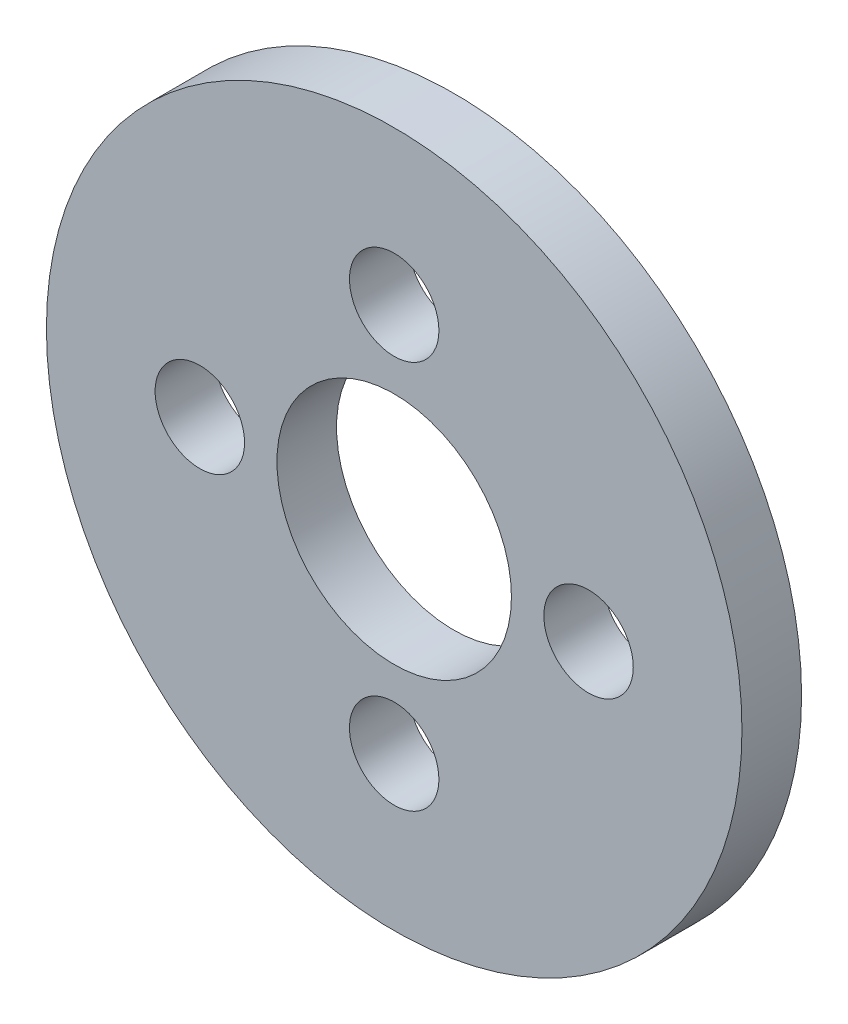
from build123d import *

# Parameters (mm, degrees)
SKETCH1_R           = 17.5
SKETCH1_R_2         = 5.9
BOSS_EXTRUDE1_DEPTH = 3
SKETCH3_R           = 2.25
CUT_EXTRUDE2_DEPTH  = 3


with BuildPart() as part:
    # Sketch1 → Boss-Extrude1 (new body)
    with BuildSketch(Plane.XY):
        Circle(SKETCH1_R)
        Circle(SKETCH1_R_2, mode=Mode.SUBTRACT)
    extrude(amount=BOSS_EXTRUDE1_DEPTH)

    # Sketch3 → Cut-Extrude2 (cut)
    with BuildSketch(Plane.XY.offset(3)):
        with Locations((0, 9.78)):
            Circle(SKETCH3_R)
        with Locations((9.78, 0)):
            Circle(SKETCH3_R)
        with Locations((0, -9.78)):
            Circle(SKETCH3_R)
        with Locations((-9.78, 0)):
            Circle(SKETCH3_R)
    extrude(amount=-CUT_EXTRUDE2_DEPTH, mode=Mode.SUBTRACT)


solid = part.part
